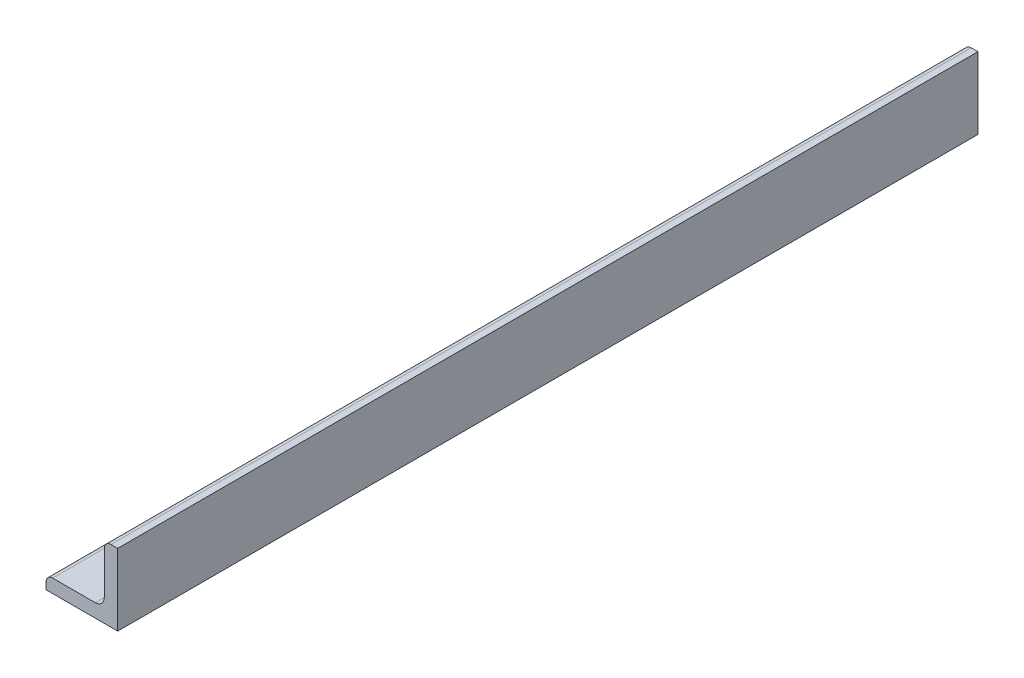
from build123d import *

# Parameters (mm, degrees)
BOSS_EXTRUDE1_DEPTH = 152.4


with BuildPart() as part:
    # Sketch2 → Boss-Extrude1 (new, symmetric)
    with BuildSketch(Plane.XY):
        with BuildLine():
            Line((-12.7, 0), (12.7, 0))
            Line((12.7, 0), (12.7, 25.4))
            Line((12.7, 25.4), (10.31875, 25.4))
            ThreePointArc((10.31875, 25.4), (8.634951977, 24.702548023), (7.9375, 23.01875))
            Line((7.9375, 23.01875), (7.9375, 7.9375))
            ThreePointArc((7.9375, 7.9375), (7.00756403, 5.69243597), (4.7625, 4.7625))
            Line((4.7625, 4.7625), (-10.31875, 4.7625))
            ThreePointArc((-10.31875, 4.7625), (-12.002548023, 4.065048023), (-12.7, 2.38125))
            Line((-12.7, 2.38125), (-12.7, 0))
        make_face()
    extrude(amount=BOSS_EXTRUDE1_DEPTH, both=True)


solid = part.part
